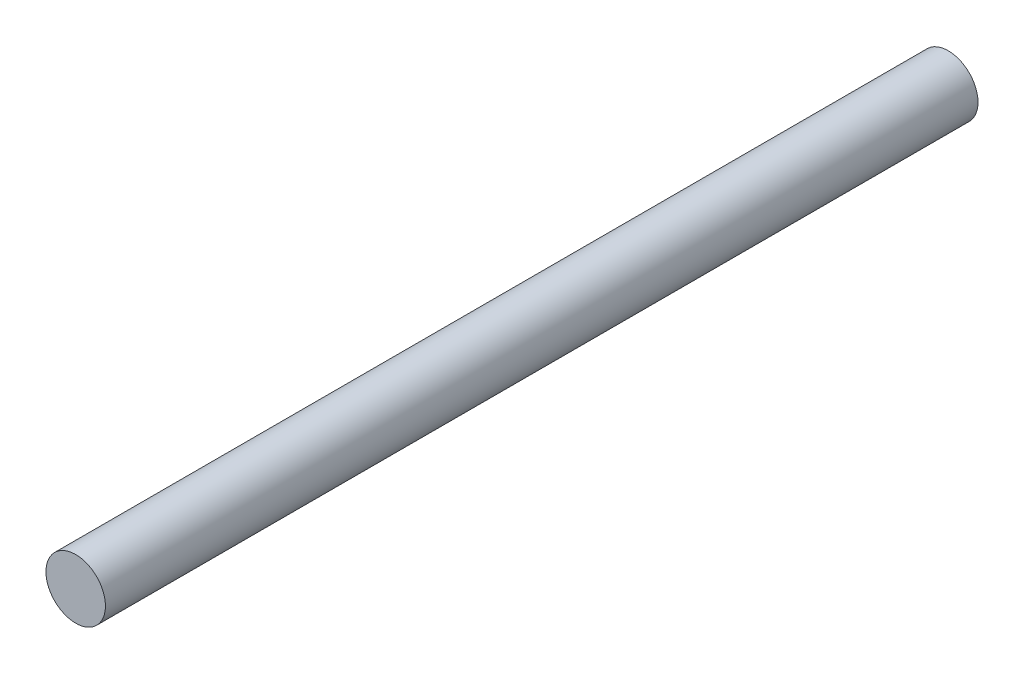
from build123d import *

# Parameters (mm, degrees)
CROQUIS1_R              = 1.5
SALIENTE_EXTRUIR1_DEPTH = 22


with BuildPart() as part:
    # Croquis1 → Saliente-Extruir1 (new, symmetric)
    with BuildSketch(Plane.XY):
        Circle(CROQUIS1_R)
    extrude(amount=SALIENTE_EXTRUIR1_DEPTH, both=True)


solid = part.part
